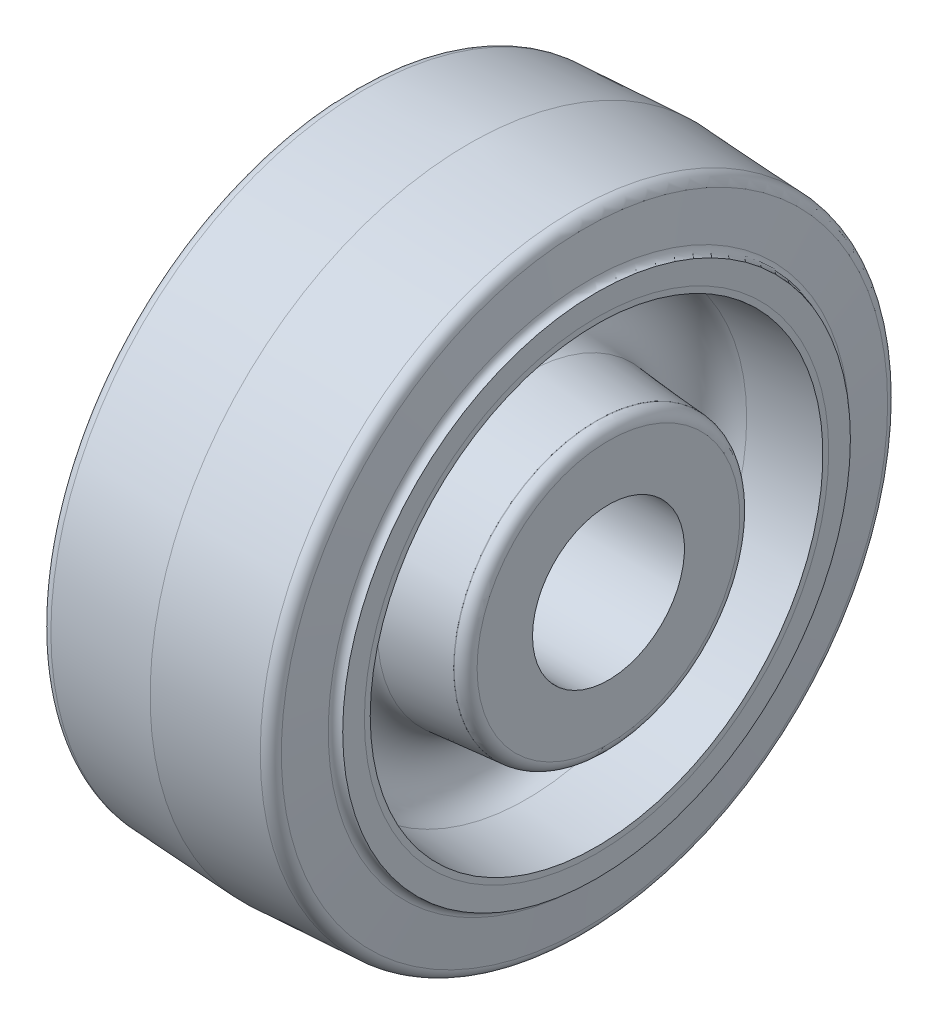
from build123d import *


with BuildPart() as part:
    # Sketch4 → Revolve3 (revolve)
    with BuildSketch(Plane.XY, mode=Mode.PRIVATE) as revolve3_sk:
        with BuildLine():
            Line((25.4, 46.228), (25.4, 50.546))
            ThreePointArc((25.4, 50.546), (24.380244956, 50.937447286), (23.884348631, 51.910698622))
            Line((23.884348631, 51.910698622), (22.995891966, 60.363799137))
            ThreePointArc((22.995891966, 60.363799137), (22.295993473, 61.783052882), (20.842054909, 62.407714187))
            Line((20.842054909, 62.407714187), (0, 63.5))
            Line((0, 63.5), (-20.842054909, 62.407714187))
            ThreePointArc((-20.842054909, 62.407714187), (-22.295993473, 61.783052882), (-22.995891966, 60.363799137))
            Line((-22.995891966, 60.363799137), (-23.884348631, 51.910698622))
            ThreePointArc((-23.884348631, 51.910698622), (-24.380244956, 50.937447286), (-25.4, 50.546))
            Line((-25.4, 50.546), (-25.4, 46.228))
            Line((-25.4, 46.228), (-19.05, 46.228))
            Line((-19.05, 46.228), (-19.05, 53.848))
            Line((-19.05, 53.848), (19.05, 53.848))
            Line((19.05, 53.848), (19.05, 46.228))
            Line((19.05, 46.228), (25.4, 46.228))
        make_face()
    revolve(revolve3_sk.sketch.rotate(Axis((-25.4, 0, 0), (1, 0, 0)), 270), axis=Axis((-25.4, 0, 0), (1, 0, 0)))


with BuildPart() as body_2:
    # Sketch8 → Revolve4 (revolve)
    with BuildSketch(Plane(origin=(0, 0, 0), x_dir=(-1, 0, 0), z_dir=(0, 0, -1)), mode=Mode.PRIVATE) as revolve4_sk:
        with BuildLine():
            Line((-27.7749, 15.1257), (27.7749, 15.1257))
            Line((27.7749, 15.1257), (27.7749, 26.162))
            ThreePointArc((27.7749, 26.162), (27.105346102, 27.778446102), (25.4889, 28.448))
            Line((25.4889, 28.448), (25.4, 28.448))
            Line((25.4, 28.448), (25.4, 28.455777742))
            Line((25.4, 28.455777742), (11.445148358, 29.676669062))
            ThreePointArc((11.445148358, 29.676669062), (4.953, 36.761605755), (11.445148358, 43.846542448))
            Line((11.445148358, 43.846542448), (25.4, 45.067433768))
            Line((25.4, 45.067433768), (25.4, 46.228))
            Line((25.4, 46.228), (19.05, 46.228))
            Line((19.05, 46.228), (19.05, 53.848))
            Line((19.05, 53.848), (-19.05, 53.848))
            Line((-19.05, 53.848), (-19.05, 46.228))
            Line((-19.05, 46.228), (-25.4, 46.228))
            Line((-25.4, 46.228), (-25.4, 45.067433768))
            Line((-25.4, 45.067433768), (-11.445148358, 43.846542448))
            ThreePointArc((-11.445148358, 43.846542448), (-4.953, 36.761605755), (-11.445148358, 29.676669062))
            Line((-11.445148358, 29.676669062), (-25.4, 28.455777742))
            Line((-25.4, 28.455777742), (-25.4, 28.448))
            Line((-25.4, 28.448), (-25.4889, 28.448))
            ThreePointArc((-25.4889, 28.448), (-27.105346102, 27.778446102), (-27.7749, 26.162))
            Line((-27.7749, 26.162), (-27.7749, 15.1257))
        make_face()
    revolve(revolve4_sk.sketch.rotate(Axis((27.7749, 0, 0), (-1, 0, 0)), 270), axis=Axis((27.7749, 0, 0), (-1, 0, 0)))


solid = Compound([part.part, body_2.part])
